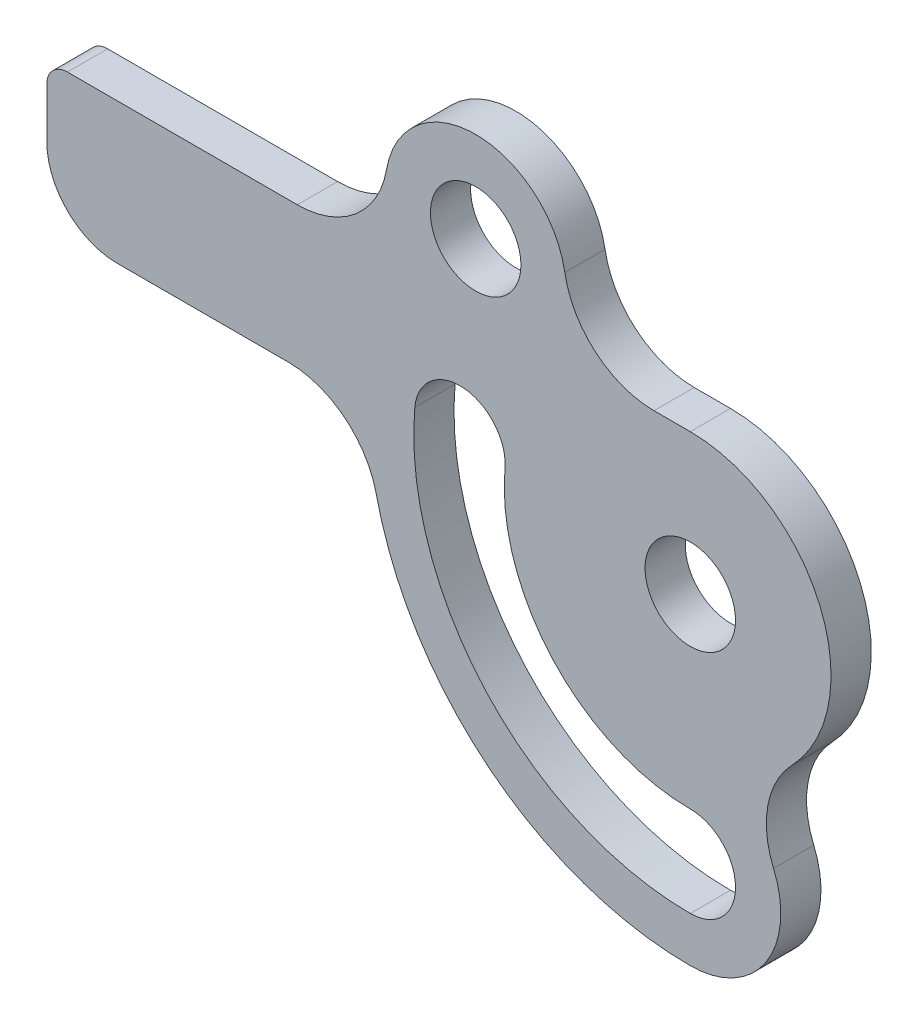
from build123d import *

# Parameters (mm, degrees)
SKETCH1_R           = 1.7859375
BOSS_EXTRUDE1_DEPTH = 1.5875
FILLET1_R           = 3.571875


with BuildPart() as part:
    # Sketch1 → Boss-Extrude1 (new body)
    with BuildSketch(Plane.XY):
        with BuildLine():
            ThreePointArc((25.4, -12.7), (28.971875, -9.128125), (25.4, -5.55625))
            ThreePointArc((25.4, -5.55625), (30.95625, 0), (25.4, 5.55625))
            Line((25.4, 5.55625), (19.614019559, 5.55625))
            ThreePointArc((19.614019559, 5.55625), (16.929229109, 11.484009389), (14.244438658, 5.55625))
            Line((14.244438658, 5.55625), (0.813693974, 5.55625))
            ThreePointArc((0.813693974, 5.55625), (0.238325447, 5.317924553), (0, 4.742556026))
            Line((0, 4.742556026), (0, 2.778125))
            ThreePointArc((0, 2.778125), (0.813693974, 0.813693974), (2.778125, 0))
            Line((2.778125, 0), (12.7, 0))
            ThreePointArc((12.7, 0), (16.419743879, -8.980256121), (25.4, -12.7))
        make_face()
        with BuildLine():
            ThreePointArc((18.08575174, 0.639913805), (19.986771554, -4.960309977), (25.4, -7.3421875))
            ThreePointArc((25.4, -7.3421875), (27.1859375, -9.128125), (25.4, -10.9140625))
            ThreePointArc((25.4, -10.9140625), (17.353309066, -7.37343375), (14.527468803, 0.951223224))
            ThreePointArc((14.527468803, 0.951223224), (16.462264981, 2.574709983), (18.08575174, 0.639913805))
        make_face(mode=Mode.SUBTRACT)
        with Locations((25.4, 0)):
            Circle(SKETCH1_R, mode=Mode.SUBTRACT)
        with Locations((16.929229109, 7.912134389)):
            Circle(SKETCH1_R, mode=Mode.SUBTRACT)
    extrude(amount=BOSS_EXTRUDE1_DEPTH)

    # Fillet1
    fillet1_edges = [part.edges().sort_by_distance(p)[0] for p in [
        (14.244438658, 5.55625, 0.79375),
        (19.614019559, 5.55625, 0.79375),
        (25.4, -5.55625, 0.79375),
        (12.7, 0, 0.79375),
    ]]
    fillet(fillet1_edges, radius=FILLET1_R)


solid = part.part
